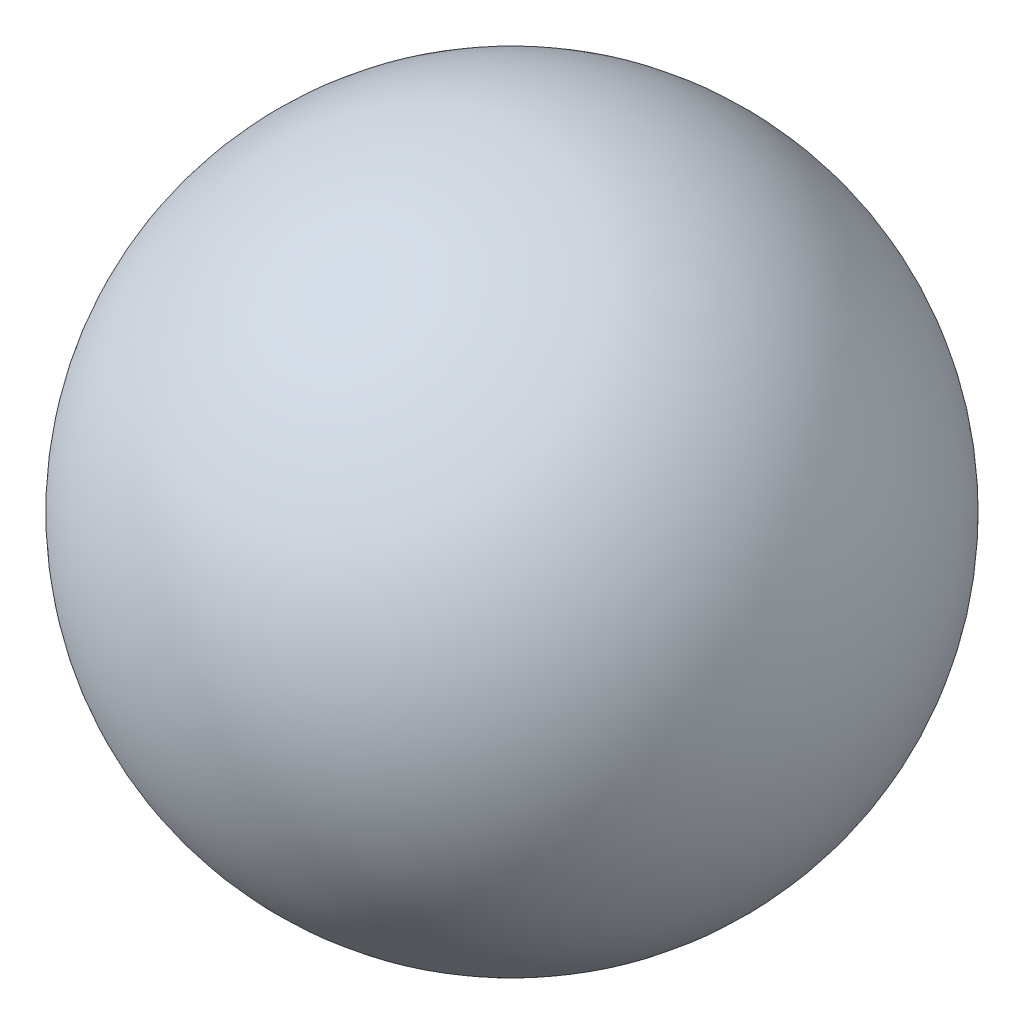
from build123d import *


with BuildPart() as part:
    # Sketch1 → Revolve1 (revolve)
    with BuildSketch(Plane(origin=(0, 0, 0), x_dir=(0, 0, -1), z_dir=(1, 0, 0))):
        with BuildLine():
            Line((0, 50.8), (0, -50.8))
            ThreePointArc((0, -50.8), (50.8, 0), (0, 50.8))
        make_face()
    revolve(axis=Axis((0, 50.8, 0), (0, -1, 0)))


solid = part.part
